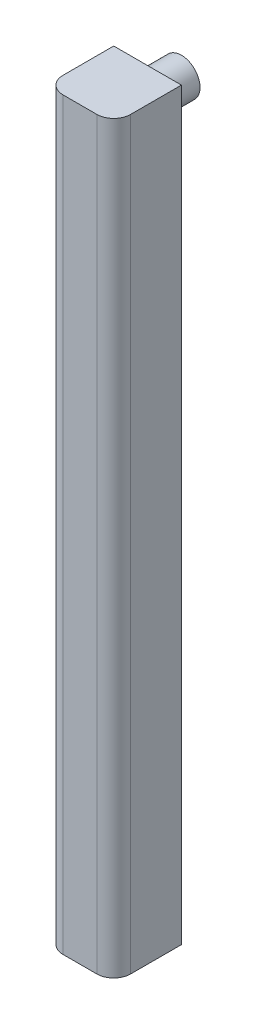
from build123d import *

# Parameters (mm, degrees)
SKETCH2_W           = 10
SKETCH2_H           = 110
BOSS_EXTRUDE1_DEPTH = 10
SKETCH3_R           = 2.75
BOSS_EXTRUDE2_DEPTH = 5
FILLET2_R           = 2.5


with BuildPart() as part:
    # Sketch2 → Boss-Extrude1 (new body)
    with BuildSketch(Plane.XY):
        with Locations((5, 55)):
            Rectangle(SKETCH2_W, SKETCH2_H)
    extrude(amount=BOSS_EXTRUDE1_DEPTH)

    # Sketch3 → Boss-Extrude2 (add)
    with BuildSketch(Plane(origin=(0, 0, 0), x_dir=(-1, 0, 0), z_dir=(0, 0, -1))):
        with Locations((-5, 106.074407224)):
            Circle(SKETCH3_R)
    extrude(amount=BOSS_EXTRUDE2_DEPTH)

    # Fillet2
    fillet2_edges = [part.edges().sort_by_distance(p)[0] for p in [
        (0, 55, 10),
        (10, 55, 10),
    ]]
    fillet(fillet2_edges, radius=FILLET2_R)


solid = part.part
